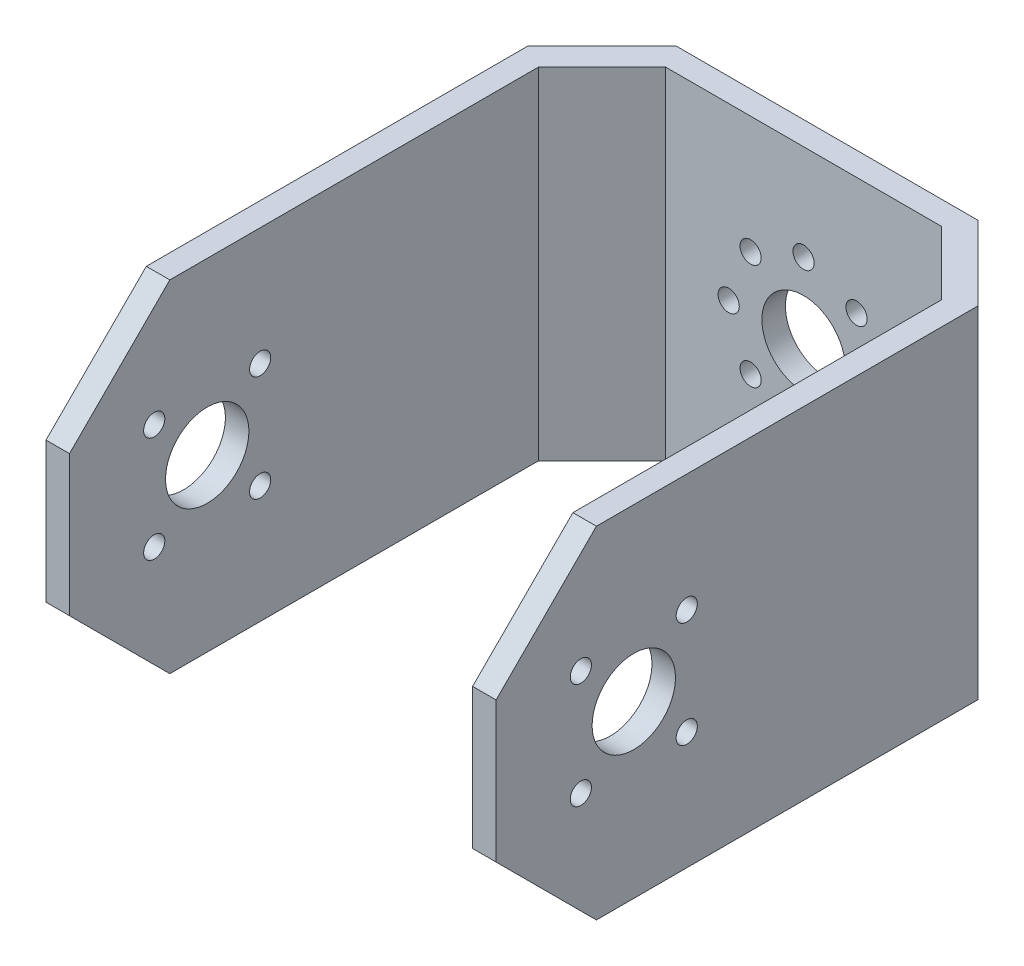
from build123d import *

# Parameters (mm, degrees)
BOSS_EXTRUDE1_DEPTH = 16.1
CUT_EXTRUDE1_DEPTH  = 32.2
SKETCH3_R           = 3.935
SKETCH3_R_2         = 1
CUT_EXTRUDE2_DEPTH  = 32.2
SKETCH4_R           = 3.935
SKETCH4_R_2         = 1
CUT_EXTRUDE3_DEPTH  = 32.2
CHAMFER1_SIZE       = 6
CHAMFER2_SIZE       = 7


with BuildPart() as part:
    # Sketch1 → Boss-Extrude1 (new, symmetric)
    with BuildSketch(Plane(origin=(0, 0, 0), x_dir=(1, 0, 0), z_dir=(0, 1, 0))):
        Polygon((0, 0), (-21.25, 0), (-21.25, -52.5), (-19.03, -52.5), (-19.03, -2.22), (0, -2.22), align=None)
    boss_extrude1 = extrude(amount=BOSS_EXTRUDE1_DEPTH, both=True)

    # Sketch2 → Cut-Extrude1 (cut)
    with BuildSketch(Plane.ZY.offset(21.25)):
        Polygon((43.03, 16.1), (52.5, 6.63), (52.5, 16.1), align=None)
        Polygon((52.5, -6.63), (43.03, -16.1), (52.5, -16.1), align=None)
    cut_extrude1 = extrude(amount=-CUT_EXTRUDE1_DEPTH, mode=Mode.SUBTRACT)

    # Sketch3 → Cut-Extrude2 (cut)
    with BuildSketch(Plane.ZY.offset(21.25)):
        with Locations((39.5, 0)):
            Circle(SKETCH3_R)
        with Locations((34.5, 5)):
            Circle(SKETCH3_R_2)
        with Locations((44.5, 5)):
            Circle(SKETCH3_R_2)
        with Locations((44.5, -5)):
            Circle(SKETCH3_R_2)
        with Locations((34.5, -5)):
            Circle(SKETCH3_R_2)
    cut_extrude2 = extrude(amount=-CUT_EXTRUDE2_DEPTH, mode=Mode.SUBTRACT)

    # Mirror1: Boss-Extrude1, Cut-Extrude1, Cut-Extrude2 across plane
    add(boss_extrude1.mirror(Plane(origin=(0, 16.1, 2.22), x_dir=(0, 0, 1), z_dir=(-1, 0, 0))))
    add(cut_extrude1.mirror(Plane(origin=(0, 16.1, 2.22), x_dir=(0, 0, 1), z_dir=(-1, 0, 0))), mode=Mode.SUBTRACT)
    add(cut_extrude2.mirror(Plane(origin=(0, 16.1, 2.22), x_dir=(0, 0, 1), z_dir=(-1, 0, 0))), mode=Mode.SUBTRACT)

    # Sketch4 → Cut-Extrude3 (cut)
    with BuildSketch(Plane.XY.offset(2.22)):
        Circle(SKETCH4_R)
        with Locations((-5, 5)):
            Circle(SKETCH4_R_2)
        with Locations((5, 5)):
            Circle(SKETCH4_R_2)
        with Locations((5, -5)):
            Circle(SKETCH4_R_2)
        with Locations((-5, -5)):
            Circle(SKETCH4_R_2)
        with Locations((-7.071067812, 0)):
            Circle(SKETCH4_R_2)
        with Locations((0, 7.071067812)):
            Circle(SKETCH4_R_2)
        with Locations((7.071067812, 0)):
            Circle(SKETCH4_R_2)
        with Locations((0, -7.071067812)):
            Circle(SKETCH4_R_2)
    extrude(amount=-CUT_EXTRUDE3_DEPTH, mode=Mode.SUBTRACT)

    # Chamfer1
    chamfer1_edges = [part.edges().sort_by_distance(p)[0] for p in [
        (-19.03, 0, 2.22),
        (19.03, 0, 2.22),
    ]]
    chamfer(chamfer1_edges, length=CHAMFER1_SIZE)

    # Chamfer2
    chamfer2_edges = [part.edges().sort_by_distance(p)[0] for p in [
        (-21.25, 0, 0),
        (21.25, 0, 0),
    ]]
    chamfer(chamfer2_edges, length=CHAMFER2_SIZE)


solid = part.part
